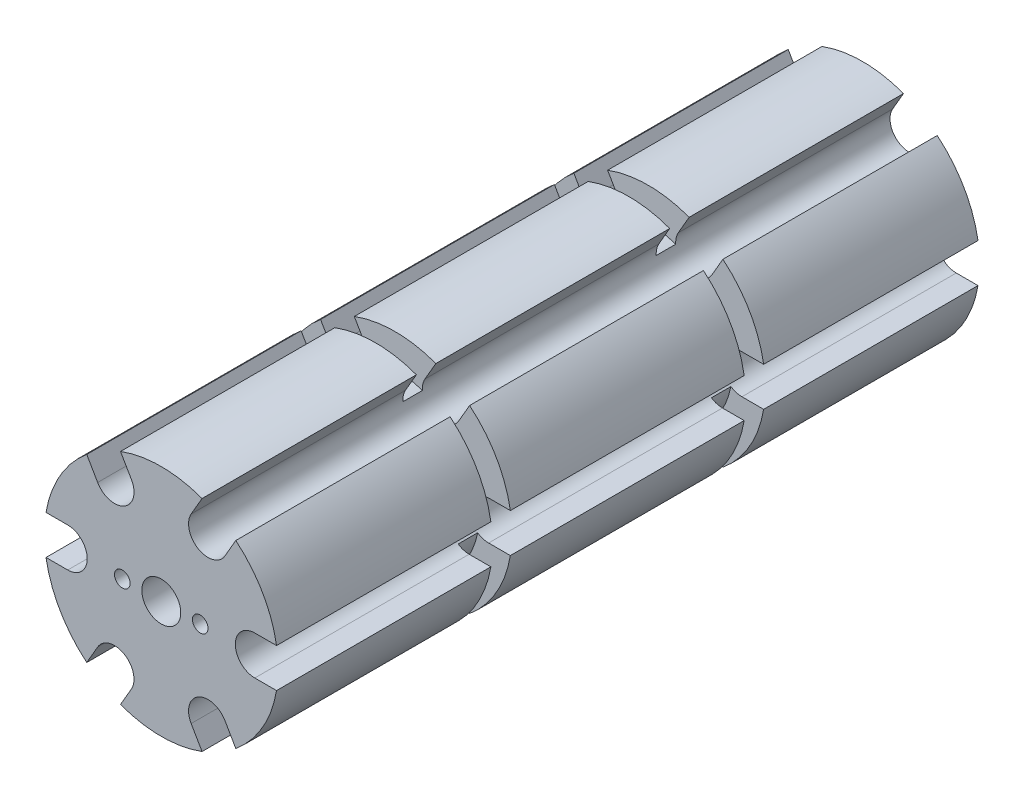
from build123d import *

# Parameters (mm, degrees)
SKETCH_1_R          = 2
EXTRUDE_1_DEPTH     = 180
SKETCH_2_R          = 5
CUT_EXTRUDE_1_DEPTH = 180
SKETCH_3_W          = 11.661291253
SKETCH_3_H          = 5


with BuildPart() as part:
    # 草图1 → 凸台-拉伸1 (new body)
    with BuildSketch(Plane.XY):
        with BuildLine():
            Line((-24, 5), (-29.580398915, 5))
            ThreePointArc((-29.580398915, 5), (-25.980762114, 15), (-19.120326477, 23.117376915))
            Line((-19.120326477, 23.117376915), (-16.330127019, 18.284609691))
            ThreePointArc((-16.330127019, 18.284609691), (-9.5, 16.454482672), (-7.669872981, 23.284609691))
            Line((-7.669872981, 23.284609691), (-10.460072439, 28.117376915))
            ThreePointArc((-10.460072439, 28.117376915), (0, 30), (10.460072439, 28.117376915))
            Line((10.460072439, 28.117376915), (7.669872981, 23.284609691))
            ThreePointArc((7.669872981, 23.284609691), (9.5, 16.454482672), (16.330127019, 18.284609691))
            Line((16.330127019, 18.284609691), (19.120326477, 23.117376915))
            ThreePointArc((19.120326477, 23.117376915), (25.980762114, 15), (29.580398915, 5))
            Line((29.580398915, 5), (24, 5))
            ThreePointArc((24, 5), (19, 0), (24, -5))
            Line((24, -5), (29.580398915, -5))
            ThreePointArc((29.580398915, -5), (25.980762114, -15), (19.120326477, -23.117376915))
            Line((19.120326477, -23.117376915), (16.330127019, -18.284609691))
            ThreePointArc((16.330127019, -18.284609691), (9.5, -16.454482672), (7.669872981, -23.284609691))
            Line((7.669872981, -23.284609691), (10.460072439, -28.117376915))
            ThreePointArc((10.460072439, -28.117376915), (0, -30), (-10.460072439, -28.117376915))
            Line((-10.460072439, -28.117376915), (-7.669872981, -23.284609691))
            ThreePointArc((-7.669872981, -23.284609691), (-9.5, -16.454482672), (-16.330127019, -18.284609691))
            Line((-16.330127019, -18.284609691), (-19.120326477, -23.117376915))
            ThreePointArc((-19.120326477, -23.117376915), (-25.980762114, -15), (-29.580398915, -5))
            Line((-29.580398915, -5), (-24, -5))
            ThreePointArc((-24, -5), (-19, 0), (-24, 5))
        make_face()
        with Locations((-10, 0)):
            Circle(SKETCH_1_R, mode=Mode.SUBTRACT)
        with Locations((10, 0)):
            Circle(SKETCH_1_R, mode=Mode.SUBTRACT)
    extrude(amount=EXTRUDE_1_DEPTH)

    # 草图2 → 切除-拉伸1 (cut)
    with BuildSketch(Plane(origin=(0, 0, 0), x_dir=(-1, 0, 0), z_dir=(0, 0, -1))):
        Circle(SKETCH_2_R)
    extrude(amount=-CUT_EXTRUDE_1_DEPTH, mode=Mode.SUBTRACT)

    # 草图3 → 切除-旋转1 (revolve, cut)
    with BuildSketch(Plane(origin=(0, 0, 0), x_dir=(1, 0, 0), z_dir=(0, 1, 0))):
        with Locations((-27.411044542, -57.5)):
            Rectangle(SKETCH_3_W, SKETCH_3_H)
    cut_revolve_1 = revolve(axis=Axis((0, 0, -56.149742432), (0, 0, 1)), mode=Mode.SUBTRACT)

    # 镜向1: 切除-旋转1 across plane
    add(cut_revolve_1.mirror(Plane.XY.offset(90)), mode=Mode.SUBTRACT)


solid = part.part
